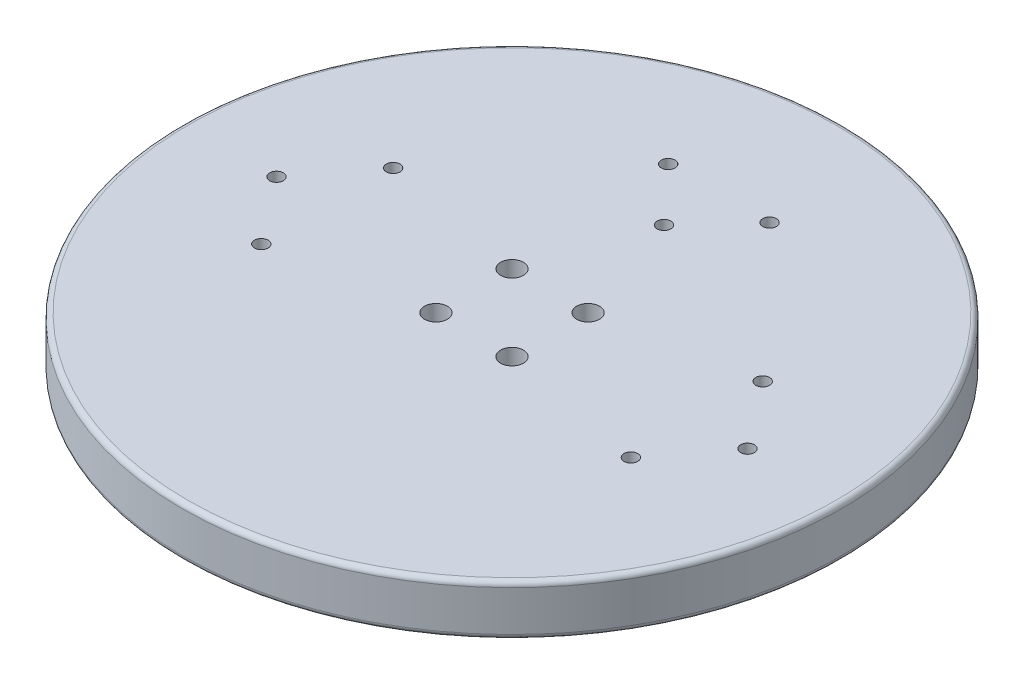
from build123d import *

# Parameters (mm, degrees)
SKETCH1_R             = 65
BOSS_EXTRUDE1_DEPTH   = 10
FILLET1_R             = 1
F_6_32_TAPPED_HOLE1_D = 2.7051
F_8_CLEARANCE_HOLE1_D = 4.4958


with BuildPart() as part:
    # Sketch1 → Boss-Extrude1 (new body)
    with BuildSketch(Plane(origin=(0, 0, 0), x_dir=(1, 0, 0), z_dir=(0, 1, 0))):
        with Locations(Location((0, 0, 0), (0, 0, 270))):
            Circle(SKETCH1_R)
    extrude(amount=BOSS_EXTRUDE1_DEPTH)

    # Fillet1
    fillet1_edges = [part.edges().sort_by_distance(p)[0] for p in [
        (0, 0, -65),
        (0, 10, -65),
    ]]
    fillet(fillet1_edges, radius=FILLET1_R)

    # #6-32 Tapped Hole1 (through all)
    with Locations(Plane.XZ):
        with Locations((-46.445, 0), (46.445, 0), (-36.445, -13), (-36.445, 13), (36.445, 13), (36.445, -13), (10.00119449, -40.8), (0.00119449, -29.978097245), (-9.99880551, -40.8)):
            Hole(F_6_32_TAPPED_HOLE1_D / 2)

    # #8 Clearance Hole1 (through all)
    with Locations(Plane(origin=(0, 0, 0), x_dir=(-1, 0, 0), z_dir=(0, -1, 0))):
        with Locations((7.5, -7.5), (-7.5, -7.5), (7.5, 7.5), (-7.5, 7.5)):
            Hole(F_8_CLEARANCE_HOLE1_D / 2)


solid = part.part
